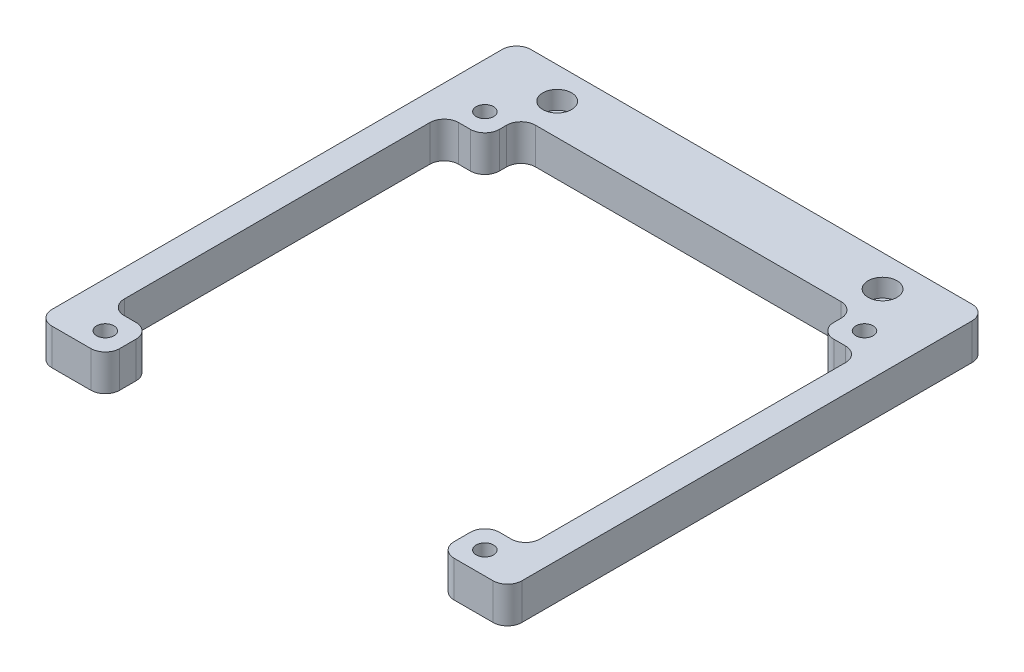
from build123d import *

# Parameters (mm, degrees)
SKETCH1_W           = 130
SKETCH1_H           = 132.5
BOSS_EXTRUDE1_DEPTH = 10
SKETCH2_R           = 2.4
CUT_EXTRUDE1_DEPTH  = 94.349143006
SKETCH3_W           = 115
SKETCH3_H           = 92.5
CUT_EXTRUDE2_DEPTH  = 94.349143006
SKETCH5_W           = 92.5
SKETCH5_H           = 115
CUT_EXTRUDE3_DEPTH  = 94.349143006
FILLET1_R           = 4
SKETCH6_R           = 2.5
CUT_EXTRUDE4_DEPTH  = 10
SKETCH7_R           = 4
CUT_EXTRUDE5_DEPTH  = 5
SKETCH8_W           = 4.2
SKETCH8_H           = 4.2
CUT_EXTRUDE6_DEPTH  = 5
SKETCH9_R           = 4
CUT_EXTRUDE7_DEPTH  = 5


with BuildPart() as part:
    # Sketch1 → Boss-Extrude1 (new body)
    with BuildSketch(Plane(origin=(0, 0, 0), x_dir=(1, 0, 0), z_dir=(0, 1, 0))):
        Rectangle(SKETCH1_W, SKETCH1_H)
    extrude(amount=BOSS_EXTRUDE1_DEPTH)

    # Sketch2 → Cut-Extrude1 (cut, through all)
    with BuildSketch(Plane(origin=(0, 10, 0), x_dir=(1, 0, 0), z_dir=(0, 1, 0))):
        with Locations(Location((-52.5, -60, 0), (0, 0, 270))):
            Circle(SKETCH2_R)
        with Locations(Location((52.5, -60, 0), (0, 0, 270))):
            Circle(SKETCH2_R)
        with Locations(Location((52.5, 45, 0), (0, 0, 270))):
            Circle(SKETCH2_R)
        with Locations(Location((-52.5, 45, 0), (0, 0, 270))):
            Circle(SKETCH2_R)
    extrude(amount=-CUT_EXTRUDE1_DEPTH, mode=Mode.SUBTRACT)

    # Sketch3 → Cut-Extrude2 (cut, through all)
    with BuildSketch(Plane(origin=(0, 10, 0), x_dir=(1, 0, 0), z_dir=(0, 1, 0))):
        with Locations((0, -7.5)):
            Rectangle(SKETCH3_W, SKETCH3_H)
    extrude(amount=-CUT_EXTRUDE2_DEPTH, mode=Mode.SUBTRACT)

    # Sketch5 → Cut-Extrude3 (cut, through all)
    with BuildSketch(Plane(origin=(0, 10, 0), x_dir=(1, 0, 0), z_dir=(0, 1, 0))):
        with Locations((0, -8.75)):
            Rectangle(SKETCH5_W, SKETCH5_H)
    extrude(amount=-CUT_EXTRUDE3_DEPTH, mode=Mode.SUBTRACT)

    # Fillet1
    fillet1_edges = [part.edges().sort_by_distance(p)[0] for p in [
        (-57.5, 5, 53.75),
        (-57.5, 5, -38.75),
        (57.5, 5, -38.75),
        (57.5, 5, 53.75),
        (46.25, 5, 53.75),
        (-46.25, 5, 53.75),
        (-46.25, 5, -38.75),
        (-46.25, 5, 66.25),
        (46.25, 5, -38.75),
        (46.25, 5, -48.75),
        (-46.25, 5, -48.75),
        (46.25, 5, 66.25),
        (65, 5, 66.25),
        (-65, 5, 66.25),
        (-65, 5, -66.25),
        (65, 5, -66.25),
    ]]
    fillet(fillet1_edges, radius=FILLET1_R)

    # Sketch6 → Cut-Extrude4 (cut)
    with BuildSketch(Plane(origin=(0, 10, 0), x_dir=(1, 0, 0), z_dir=(0, 1, 0))):
        with Locations(Location((-45, 57.5, 0), (0, 0, 270))):
            Circle(SKETCH6_R)
        with Locations(Location((45, 57.5, 0), (0, 0, 270))):
            Circle(SKETCH6_R)
    extrude(amount=-CUT_EXTRUDE4_DEPTH, mode=Mode.SUBTRACT)

    # Sketch7 → Cut-Extrude5 (cut)
    with BuildSketch(Plane(origin=(0, 10, 0), x_dir=(1, 0, 0), z_dir=(0, 1, 0))):
        with Locations(Location((-45, 57.5, 0), (0, 0, 270))):
            Circle(SKETCH7_R)
        with Locations(Location((45, 57.5, 0), (0, 0, 270))):
            Circle(SKETCH7_R)
    extrude(amount=-CUT_EXTRUDE5_DEPTH, mode=Mode.SUBTRACT)

    # Sketch8 → Cut-Extrude6 (cut)
    with BuildSketch(Plane(origin=(0, 0, 0), x_dir=(1, 0, 0), z_dir=(0, 1, 0))):
        with Locations((-55, 64.15)):
            Rectangle(SKETCH8_W, SKETCH8_H)
        with Locations((-35, 64.15)):
            Rectangle(SKETCH8_W, SKETCH8_H)
        with Locations((35, 64.15)):
            Rectangle(SKETCH8_W, SKETCH8_H)
        with Locations((55, 64.15)):
            Rectangle(SKETCH8_W, SKETCH8_H)
    extrude(amount=CUT_EXTRUDE6_DEPTH, mode=Mode.SUBTRACT)

    # Sketch9 → Cut-Extrude7 (cut)
    with BuildSketch(Plane.XZ):
        with Locations(Location((-52.5, 60, 0), (0, 0, 270))):
            Circle(SKETCH9_R)
        with Locations(Location((52.5, 60, 0), (0, 0, 270))):
            Circle(SKETCH9_R)
        with Locations(Location((-52.5, -45, 0), (0, 0, 270))):
            Circle(SKETCH9_R)
        with Locations(Location((52.5, -45, 0), (0, 0, 270))):
            Circle(SKETCH9_R)
    extrude(amount=-CUT_EXTRUDE7_DEPTH, mode=Mode.SUBTRACT)


solid = part.part
